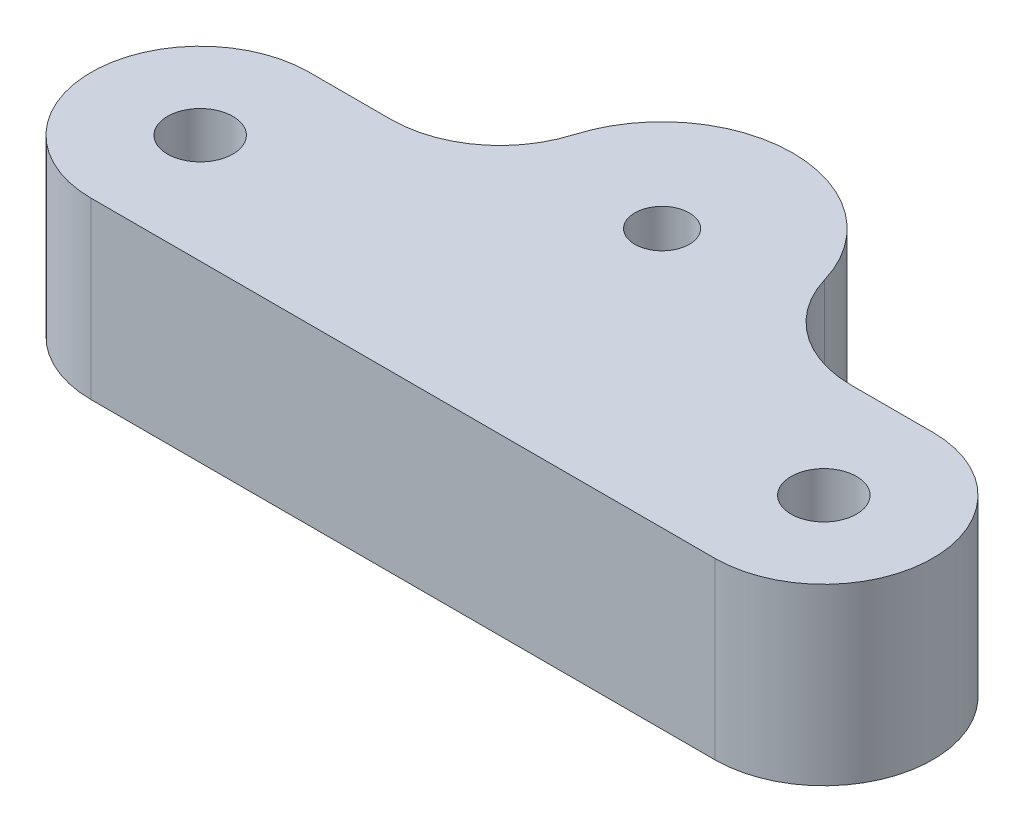
from build123d import *

# Parameters (mm, degrees)
SKETCH_1_R          = 1.5
EXTRUDE_1_DEPTH     = 8
EXTRUDE_2_DEPTH     = 8
SKETCH_3_R          = 3.25
CUT_EXTRUDE_1_DEPTH = 4
FILLET_1_R          = 5
HOLE_WIZARD_M3_1_D  = 2.5


with BuildPart() as part:
    # 草图1 → 凸台-拉伸1 (new body)
    with BuildSketch(Plane(origin=(0, 0, 0), x_dir=(1, 0, 0), z_dir=(0, 1, 0))):
        with BuildLine():
            Line((-14.295, 5), (14.295, 5))
            ThreePointArc((14.295, 5), (19.295, 0), (14.295, -5))
            Line((14.295, -5), (-14.295, -5))
            ThreePointArc((-14.295, -5), (-19.295, 0), (-14.295, 5))
        make_face()
        with Locations(Location((-14.295, 0, 0), (0, 0, 270))):
            Circle(SKETCH_1_R, mode=Mode.SUBTRACT)
        with Locations(Location((14.295, 0, 0), (0, 0, 270))):
            Circle(SKETCH_1_R, mode=Mode.SUBTRACT)
    extrude(amount=EXTRUDE_1_DEPTH)

    # 草图2 → 凸台-拉伸2 (add)
    with BuildSketch(Plane(origin=(0, 8, 0), x_dir=(1, 0, 0), z_dir=(0, 1, 0))):
        with BuildLine():
            Line((-6, 6.88), (-6, 5))
            Line((-6, 5), (6, 5))
            Line((6, 5), (6, 6.88))
            ThreePointArc((6, 6.88), (0, 12.88), (-6, 6.88))
        make_face()
    extrude(amount=-EXTRUDE_2_DEPTH)

    # 草图3 → 切除-拉伸1 (cut)
    with BuildSketch(Plane.XZ):
        with Locations(Location((0, -6.88, 0), (0, 0, 270))):
            Circle(SKETCH_3_R)
    extrude(amount=-CUT_EXTRUDE_1_DEPTH, mode=Mode.SUBTRACT)

    # 圆角1
    fillet_1_edges = [part.edges().sort_by_distance(p)[0] for p in [
        (-6, 4, -5),
        (6, 4, -5),
    ]]
    fillet(fillet_1_edges, radius=FILLET_1_R)

    # M3 螺纹孔1 (through all)
    with Locations(Plane(origin=(0, 4, -6.88), x_dir=(0, 0, -1), z_dir=(0, -1, 0))):
        with Locations((0, 0)):
            Hole(HOLE_WIZARD_M3_1_D / 2)


solid = part.part
